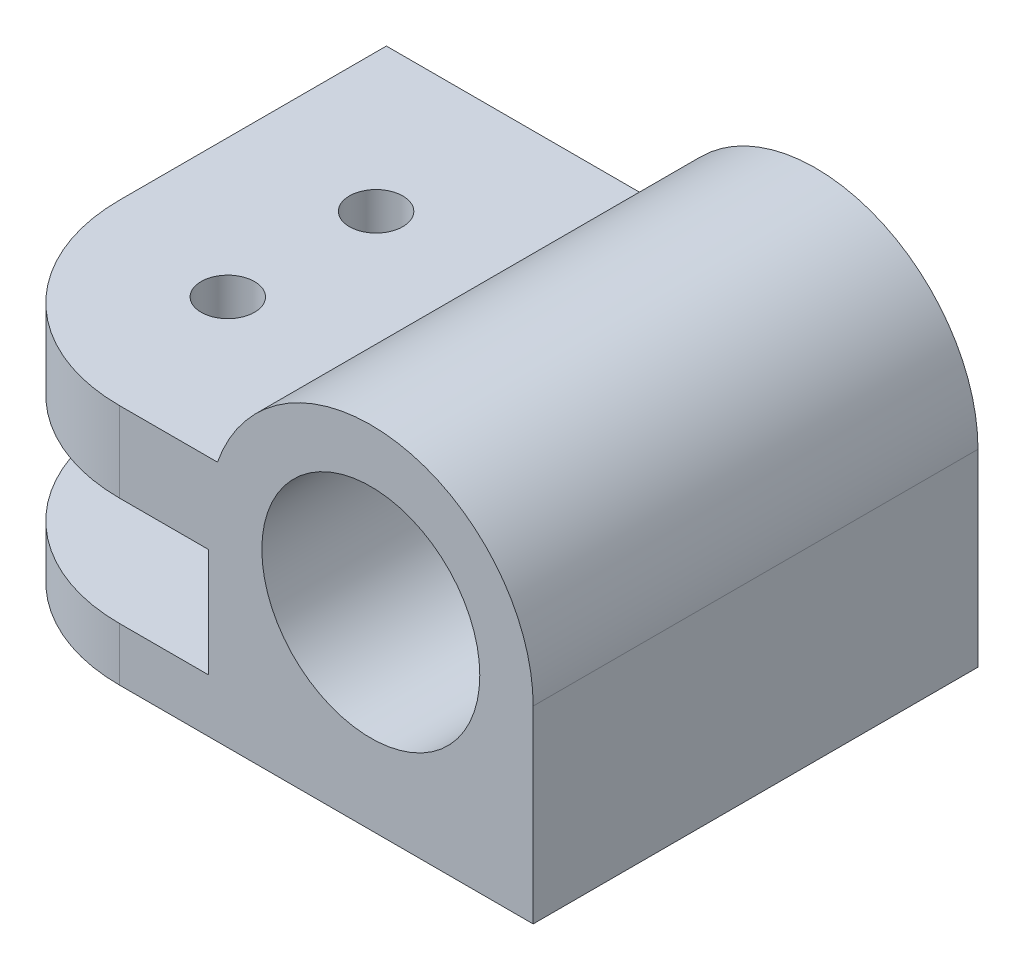
from build123d import *

# Parameters (mm, degrees)
ESQUISSE1_R                  = 9.125
ESQUISSE1_R_2                = 6.125
BOSS_EXTRU_1_DEPTH           = 25
ESQUISSE13_W                 = 33.25
ESQUISSE13_H                 = 25
BOSS_EXTRU_10_DEPTH          = 3
BOSS_EXTRU_11_DEPTH          = 3
BOSS_EXTRU_11_DEPTH_BACK     = 1.503194454
ESQUISSE14_W                 = 16.5
ESQUISSE14_H                 = 25
ENL_V_MAT_EXTRU_1_DEPTH      = 38.311344137
ENL_V_MAT_EXTRU_1_DEPTH_BACK = 38.311344137
ESQUISSE15_R                 = 1.5
CONG_1_R                     = 10


with BuildPart() as part:
    # Esquisse1 → Boss.-Extru.1 (new body)
    # profile 1 of 2: a face of its own
    with BuildSketch(Plane.XY):
        Circle(ESQUISSE1_R)
        Circle(ESQUISSE1_R_2, mode=Mode.SUBTRACT)
    # profile 2 of 2: a face of its own
    with BuildSketch(Plane.XY):
        with BuildLine():
            ThreePointArc((9.125, 0), (0, -9.125), (-9.125, 0))
            Line((-9.125, 0), (-9.125, -10.60590961))
            Line((-9.125, -10.60590961), (9.125, -10.60590961))
            Line((9.125, -10.60590961), (9.125, 0))
        make_face()
    extrude(amount=BOSS_EXTRU_1_DEPTH)

    # Esquisse13 → Boss.-Extru.10 (add)
    with BuildSketch(Plane.XZ.offset(10.60590961)):
        with Locations((-7.5, 12.5)):
            Rectangle(ESQUISSE13_W, ESQUISSE13_H)
    extrude(amount=-BOSS_EXTRU_10_DEPTH)

    # Esquisse14 → Boss.-Extru.11 (add, two sides: drawn at the far end of the back side and taken through both)
    with BuildSketch(Plane(origin=(0, 0, 0), x_dir=(1, 0, 0), z_dir=(0, 1, 0)).offset(-BOSS_EXTRU_11_DEPTH_BACK)):
        with Locations((-15.875, -12.5)):
            Rectangle(ESQUISSE14_W, ESQUISSE14_H)
    extrude(amount=BOSS_EXTRU_11_DEPTH + BOSS_EXTRU_11_DEPTH_BACK)

    # Esquisse15 → Enlèv. mat.-Extru.1 (cut, two sides: drawn at the far end of the back side and taken through both)
    with BuildSketch(Plane(origin=(0, 3, 0), x_dir=(1, 0, 0), z_dir=(0, 1, 0)).offset(-ENL_V_MAT_EXTRU_1_DEPTH_BACK)):
        with Locations(Location((-16.37, -8.333333333, 0), (0, 0, 270))):
            Circle(ESQUISSE15_R)
        with Locations(Location((-16.37, -16.666666667, 0), (0, 0, 270))):
            Circle(ESQUISSE15_R)
    extrude(amount=ENL_V_MAT_EXTRU_1_DEPTH + ENL_V_MAT_EXTRU_1_DEPTH_BACK, mode=Mode.SUBTRACT)

    # Congé1
    cong_1_edges = [part.edges().sort_by_distance(p)[0] for p in [
        (-24.125, -9.10590961, 25),
        (-24.125, 0.748402773, 25),
    ]]
    fillet(cong_1_edges, radius=CONG_1_R)


solid = part.part
